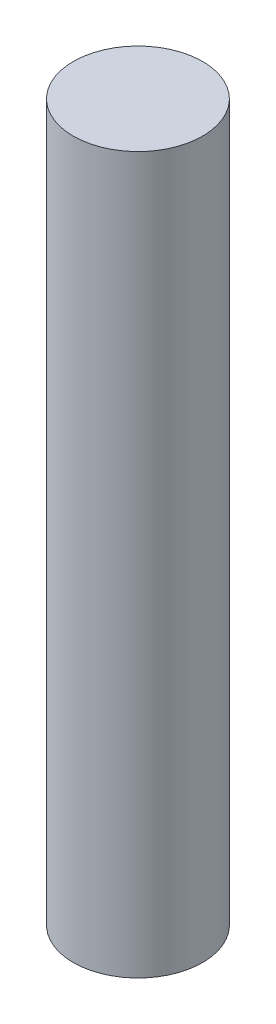
from build123d import *

# Parameters (mm, degrees)
BOSS_EXTRUDE1_DEPTH      = 223
BOSS_EXTRUDE1_DEPTH_BACK = 275
SKETCH1_R                = 45


with BuildPart() as part:
    # Sketch1 → Boss-Extrude1 (new, two sides: drawn at the far end of the back side and taken through both)
    with BuildSketch(Plane(origin=(0, 0, 0), x_dir=(1, 0, 0), z_dir=(0, 1, 0)).offset(-BOSS_EXTRUDE1_DEPTH_BACK)):
        with Locations(Location((0, 0, 0), (0, 0, 270))):
            Circle(SKETCH1_R)
    extrude(amount=BOSS_EXTRUDE1_DEPTH + BOSS_EXTRUDE1_DEPTH_BACK)


solid = part.part
